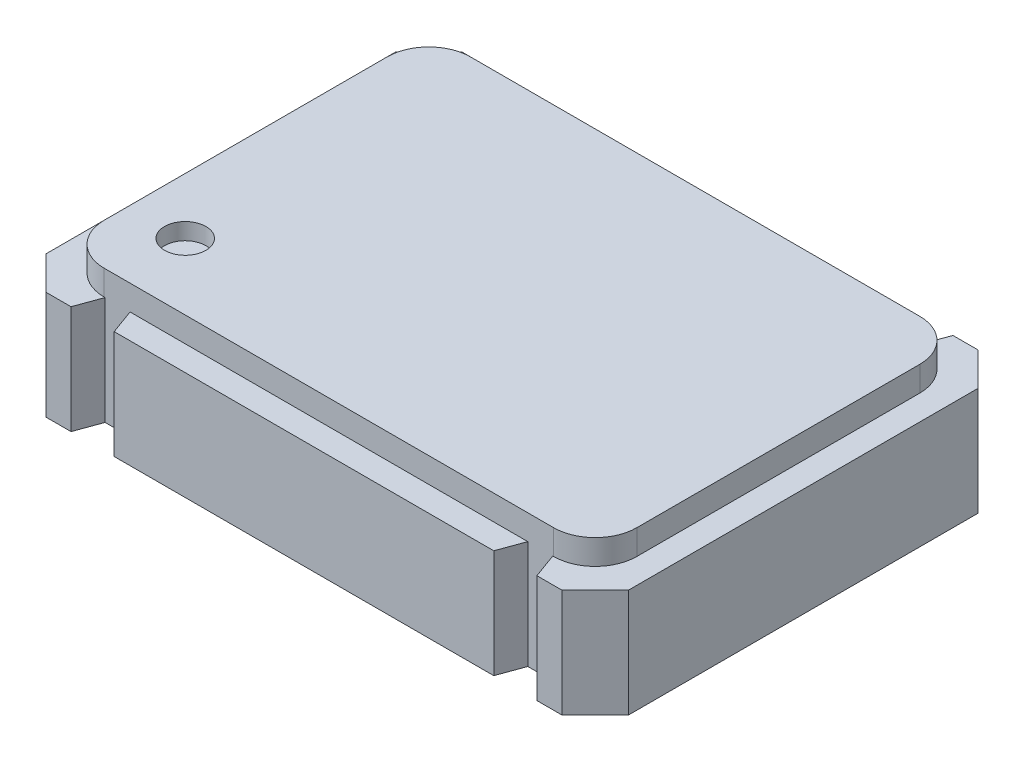
from build123d import *
from OCP.BRepFilletAPI import BRepFilletAPI_MakeChamfer

# Parameters (mm, degrees)
BOSS_EXTRUDE1_DEPTH = 1.3
CUT_EXTRUDE1_DEPTH  = 7.730527468
CUT_EXTRUDE2_DEPTH  = 7.730527468
SKETCH4_W           = 6.4
SKETCH4_H           = 4.4
BOSS_EXTRUDE2_DEPTH = 0.3
SKETCH5_W           = 4.78
SKETCH5_H           = 1.3
BOSS_EXTRUDE3_DEPTH = 0.3
SKETCH6_W           = 4.78
SKETCH6_H           = 1.3
BOSS_EXTRUDE4_DEPTH = 0.3
DRAFT1_ANGLE        = 20
DRAFT2_ANGLE        = 20
HOLE1_D             = 0.497503641
HOLE1_DEPTH         = 0.2
CHAMFER1_SIZE       = 0.234692934
CHAMFER1_SIZE2      = 0.311889554
CHAMFER2_SIZE       = 0.311889554
CHAMFER2_SIZE2      = 0.234692934
FILLET1_R           = 0.5


with BuildPart() as part:
    # Sketch1 → Boss-Extrude1 (new body)
    with BuildSketch(Plane(origin=(0, 1.3, 0), x_dir=(1, 0, 0), z_dir=(0, 1, 0))):
        Polygon((3.5, 2.1), (0, 5.6), (-3.5, 2.1), (-3.5, -2.1), (0, -5.6), (3.5, -2.1), align=None)
    extrude(amount=-BOSS_EXTRUDE1_DEPTH)

    # Sketch2 → Cut-Extrude1 (cut, through all)
    with BuildSketch(Plane.XZ):
        Polygon((0, -5.6), (2.69, -2.91), (2.69, -2.2), (-2.69, -2.2), (-2.69, -2.91), align=None)
    extrude(amount=-CUT_EXTRUDE1_DEPTH, mode=Mode.SUBTRACT)

    # Sketch3 → Cut-Extrude2 (cut, through all)
    with BuildSketch(Plane.XZ):
        Polygon((2.69, 2.2), (2.69, 2.91), (0, 5.6), (-2.69, 2.91), (-2.69, 2.2), align=None)
    extrude(amount=-CUT_EXTRUDE2_DEPTH, mode=Mode.SUBTRACT)

    # Sketch4 → Boss-Extrude2 (add)
    with BuildSketch(Plane(origin=(0, 1.3, 0), x_dir=(-1, 0, 0), z_dir=(0, 1, 0))):
        Rectangle(SKETCH4_W, SKETCH4_H)
    extrude(amount=BOSS_EXTRUDE2_DEPTH)

    # Sketch5 → Boss-Extrude3 (add)
    with BuildSketch(Plane.XY.offset(2.2)):
        with Locations((0, 0.65)):
            Rectangle(SKETCH5_W, SKETCH5_H)
    extrude(amount=BOSS_EXTRUDE3_DEPTH)

    # Sketch6 → Boss-Extrude4 (add)
    with BuildSketch(Plane(origin=(0, 0, -2.2), x_dir=(-1, 0, 0), z_dir=(0, 0, -1))):
        with Locations((0, 0.65)):
            Rectangle(SKETCH6_W, SKETCH6_H)
    extrude(amount=BOSS_EXTRUDE4_DEPTH)

    # Draft1
    draft1_faces = [part.faces().sort_by_distance(p)[0] for p in [
        (-2.69, 0.65, -2.555),
        (-2.39, 0.65, -2.35),
        (2.39, 0.65, -2.35),
        (2.69, 0.65, -2.555),
    ]]
    draft(draft1_faces, Plane(origin=(2.69, 1.3, -2.2), x_dir=(-1, 0, 0), z_dir=(0, 0, -1)), DRAFT1_ANGLE)

    # Draft2
    draft2_faces = [part.faces().sort_by_distance(p)[0] for p in [
        (2.69, 0.65, 2.555),
        (2.39, 0.65, 2.35),
        (-2.39, 0.65, 2.35),
        (-2.69, 0.65, 2.555),
    ]]
    draft(draft2_faces, Plane(origin=(-2.69, 1.3, 2.2), x_dir=(1, 0, 0), z_dir=(0, 0, 1)), DRAFT2_ANGLE)

    # Hole1
    with Locations(Plane(origin=(0, 1.6, 0), x_dir=(1, 0, 0), z_dir=(0, 1, 0))):
        with Locations((-2.524000409, -1.40306368)):
            Hole(HOLE1_D / 2, depth=HOLE1_DEPTH)

    # Chamfer1: one chamfer whose edges measure the first distance from different faces: ONE call of the kernel's chamfer builder (chamfer() names one face for all edges)
    chamfer1_edges_1 = [part.edges().sort_by_distance(p)[0] for p in [
        (-2.879460781, 0.65, -2.720539219),
    ]]
    chamfer1_side_1 = [part.faces().sort_by_distance(p)[0] for p in [
        (-2.784730391, 0.65, -2.460269609),
    ]]
    chamfer1_edges_2 = [part.edges().sort_by_distance(p)[0] for p in [
        (2.879460781, 0.65, 2.720539219),
    ]]
    chamfer1_side_2 = [part.faces().sort_by_distance(p)[0] for p in [
        (2.784730391, 0.65, 2.460269609),
    ]]
    chamfer1 = BRepFilletAPI_MakeChamfer(part.part.solid().wrapped)
    for e in chamfer1_edges_1:
        chamfer1.Add(CHAMFER1_SIZE, CHAMFER1_SIZE2, e.wrapped, chamfer1_side_1[0].wrapped)  # the first distance lies on this face
    for e in chamfer1_edges_2:
        chamfer1.Add(CHAMFER1_SIZE, CHAMFER1_SIZE2, e.wrapped, chamfer1_side_2[0].wrapped)  # the first distance lies on this face
    add(Compound.cast(chamfer1.Shape()), mode=Mode.REPLACE)

    # Chamfer2: one chamfer whose edges measure the first distance from different faces: ONE call of the kernel's chamfer builder (chamfer() names one face for all edges)
    chamfer2_edges_1 = [part.edges().sort_by_distance(p)[0] for p in [
        (2.879460781, 0.65, -2.720539219),
    ]]
    chamfer2_side_1 = [part.faces().sort_by_distance(p)[0] for p in [
        (3.189730391, 0.65, -2.410269609),
    ]]
    chamfer2_edges_2 = [part.edges().sort_by_distance(p)[0] for p in [
        (-2.879460781, 0.65, 2.720539219),
    ]]
    chamfer2_side_2 = [part.faces().sort_by_distance(p)[0] for p in [
        (-3.189730391, 0.65, 2.410269609),
    ]]
    chamfer2 = BRepFilletAPI_MakeChamfer(part.part.solid().wrapped)
    for e in chamfer2_edges_1:
        chamfer2.Add(CHAMFER2_SIZE, CHAMFER2_SIZE2, e.wrapped, chamfer2_side_1[0].wrapped)  # the first distance lies on this face
    for e in chamfer2_edges_2:
        chamfer2.Add(CHAMFER2_SIZE, CHAMFER2_SIZE2, e.wrapped, chamfer2_side_2[0].wrapped)  # the first distance lies on this face
    add(Compound.cast(chamfer2.Shape()), mode=Mode.REPLACE)

    # Fillet1
    fillet1_edges = [part.edges().sort_by_distance(p)[0] for p in [
        (3.2, 1.45, -2.2),
        (-3.2, 1.45, -2.2),
        (-3.2, 1.45, 2.2),
        (3.2, 1.45, 2.2),
    ]]
    fillet(fillet1_edges, radius=FILLET1_R)


solid = part.part
